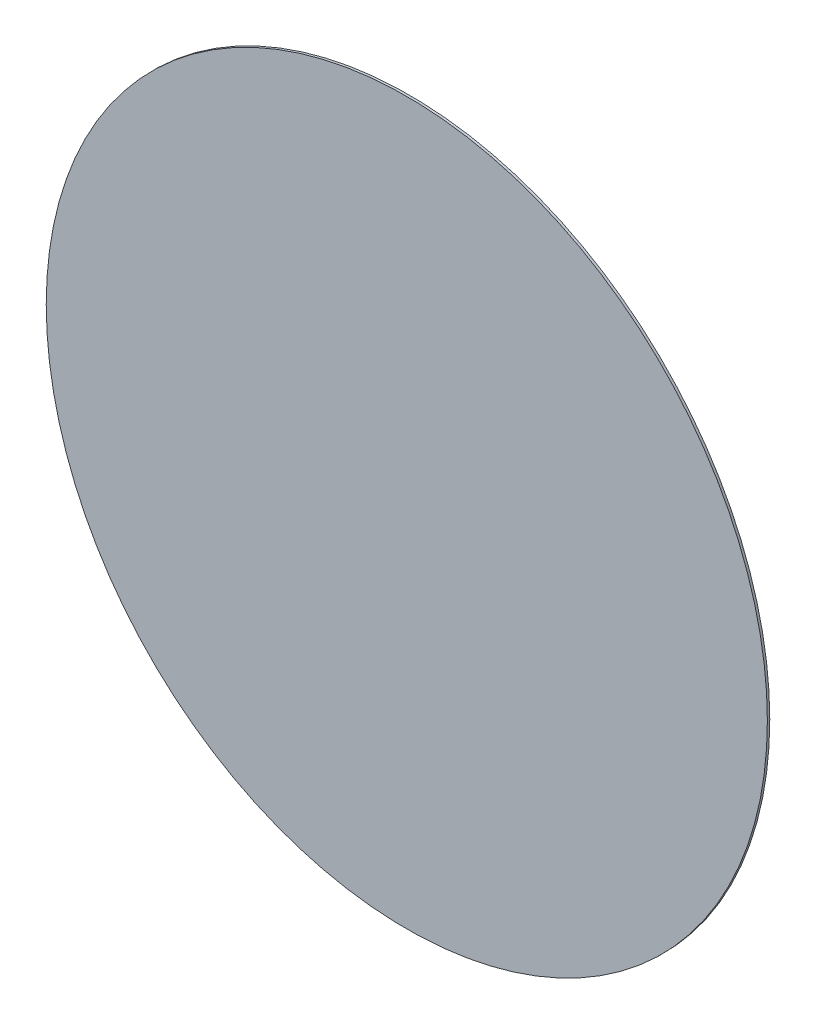
from build123d import *

# Parameters (mm, degrees)
SKETCH1_R           = 30
BOSS_EXTRUDE1_DEPTH = 0.2
SKETCH2_R           = 0.5


with BuildPart() as part:
    # Sketch1 → Boss-Extrude1 (new body)
    with BuildSketch(Plane.XY):
        Circle(SKETCH1_R)
    extrude(amount=BOSS_EXTRUDE1_DEPTH)

    # Sweep1: sweep along a path in Sketch4
    with BuildLine(Plane(origin=(14.729868629, 12.380708546, 0), x_dir=(0, 0, 1), z_dir=(-1, 0, 0))) as sweep1_path:
        Line((0, 0), (-3.5, 0))
        ThreePointArc((-3.5, 0), (-3.853553391, -0.146446609), (-4, -0.5))
        Line((-4, -0.5), (-4, -9.5))
        ThreePointArc((-4, -9.5), (-3.853553391, -9.853553391), (-3.5, -10))
        Line((-3.5, -10), (0, -10))
    # Sketch2 → Sweep1 (sweep)
    with BuildSketch(Plane(origin=(0, 0, 0), x_dir=(-1, 0, 0), z_dir=(0, 0, -1))):
        with Locations((-14.729868629, 12.380708546)):
            Circle(SKETCH2_R)
    sweep(path=sweep1_path.line)


solid = part.part
